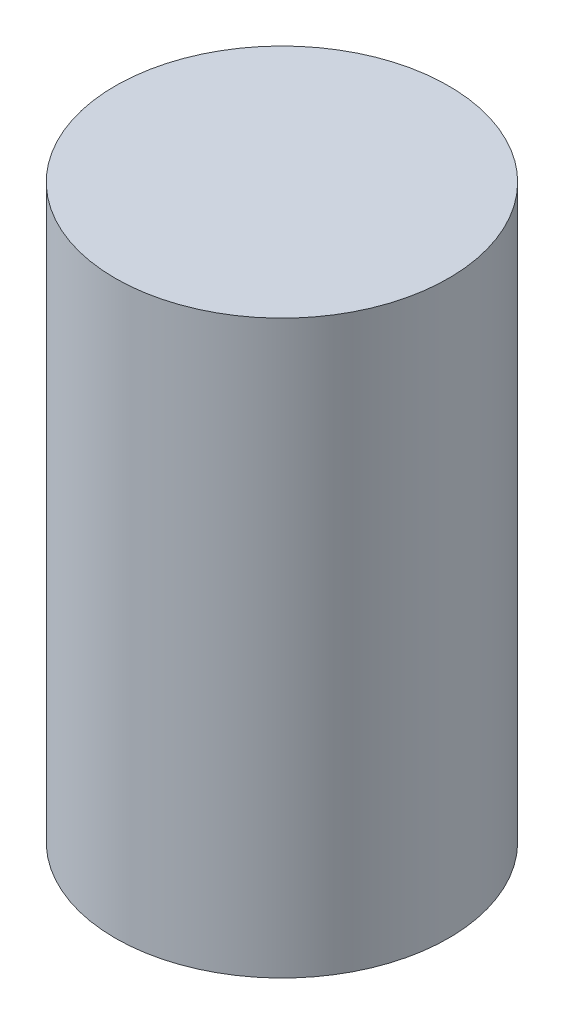
from build123d import *

# Parameters (mm, degrees)
SKETCH_1_R      = 3500
EXTRUDE_1_DEPTH = 12000


with BuildPart() as part:
    # Эскиз1 → Бобышка-Вытянуть1 (new body)
    with BuildSketch(Plane(origin=(0, 0, 0), x_dir=(1, 0, 0), z_dir=(0, 1, 0))):
        with Locations(Location((0, 0, 0), (0, 0, 270))):
            Circle(SKETCH_1_R)
    extrude(amount=EXTRUDE_1_DEPTH)


solid = part.part
